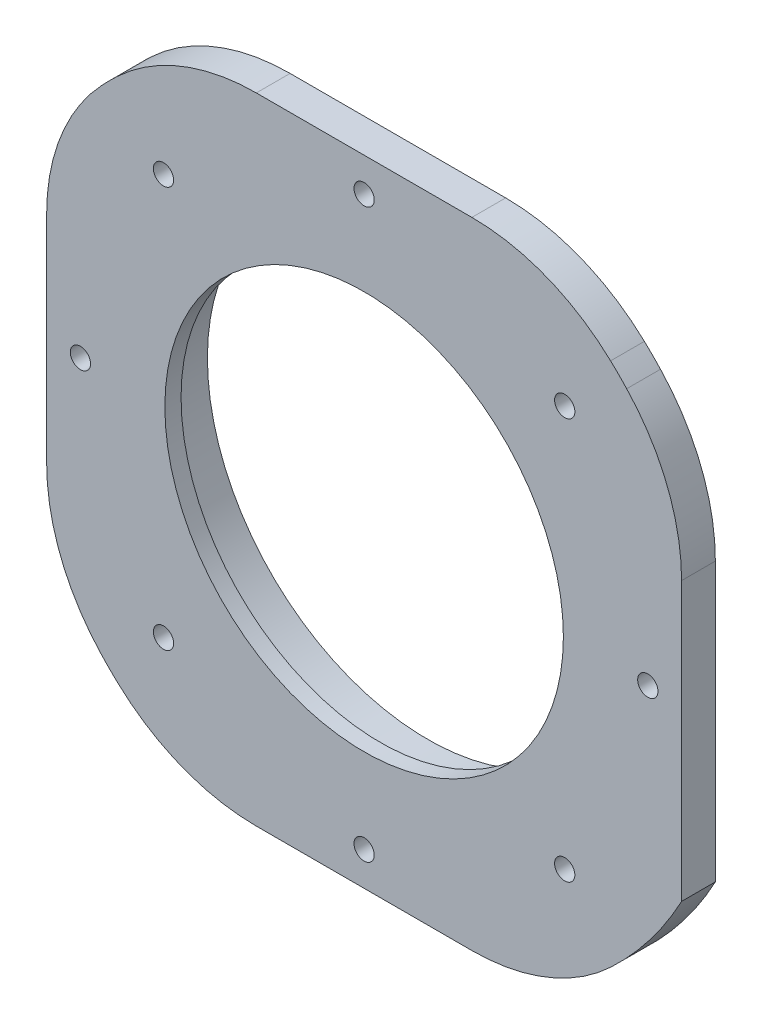
from build123d import *

# Parameters (mm, degrees)
SKETCH1_R               = 36
BOSS_EXTRUDE1_DEPTH     = 5
BOSS_EXTRUDE2_START     = -4.4
BOSS_EXTRUDE2_DEPTH     = 4.4
BOSS_EXTRUDE3_START     = -5
BOSS_EXTRUDE3_DEPTH     = 5
BOSS_EXTRUDE4_START     = 4.4
SKETCH3_R               = 32.7
SKETCH3_R_2             = 32.6
BOSS_EXTRUDE4_DEPTH     = 4.4
CUT_EXTRUDE1_DEPTH      = 68.129427228
CUT_EXTRUDE1_DEPTH_BACK = 68.129427228
SKETCH4_R               = 32.6
BOSS_EXTRUDE5_START     = -2.4
SKETCH5_R               = 29.5
BOSS_EXTRUDE5_DEPTH     = 2.4
CUT_EXTRUDE3_DEPTH      = 68.129427228
CUT_EXTRUDE3_DEPTH_BACK = 68.129427228
SKETCH6_R               = 1.5


with BuildPart() as part:
    # Sketch1 → Boss-Extrude1 (new body)
    # profile 1 of 3: a face of its own
    with BuildSketch(Plane.XY):
        with BuildLine():
            Line((15.957693357, 47), (-15.957693357, 47))
            ThreePointArc((-15.957693357, 47), (-26.99865268, 44.894394011), (-36.489751331, 38.873147815))
            ThreePointArc((-36.489751331, 38.873147815), (-37.700288946, 37.700288946), (-38.873147815, 36.489751331))
            ThreePointArc((-38.873147815, 36.489751331), (-44.894394011, 26.99865268), (-47, 15.957693357))
            Line((-47, 15.957693357), (-47, -15.957693357))
            ThreePointArc((-47, -15.957693357), (-44.894394011, -26.99865268), (-38.873147815, -36.489751331))
            ThreePointArc((-38.873147815, -36.489751331), (-37.700288946, -37.700288946), (-36.489751331, -38.873147815))
            ThreePointArc((-36.489751331, -38.873147815), (-26.99865268, -44.894394011), (-15.957693357, -47))
            Line((-15.957693357, -47), (15.957693357, -47))
            ThreePointArc((15.957693357, -47), (26.99865268, -44.894394011), (36.489751331, -38.873147815))
            ThreePointArc((36.489751331, -38.873147815), (42.303260219, -32.45085127), (47, -25.171880606))
            Line((47, -25.171880606), (47, 15.957693357))
            ThreePointArc((47, 15.957693357), (44.894394011, 26.99865268), (38.873147815, 36.489751331))
            ThreePointArc((38.873147815, 36.489751331), (37.700288946, 37.700288946), (36.489751331, 38.873147815))
            ThreePointArc((36.489751331, 38.873147815), (26.99865268, 44.894394011), (15.957693357, 47))
        make_face()
        Circle(SKETCH1_R, mode=Mode.SUBTRACT)
    # profile 2 of 3: a face of its own
    with BuildSketch(Plane.XY):
        with BuildLine():
            ThreePointArc((35.529282793, -5.802591166), (35.882127728, -2.910826297), (36, 0))
            ThreePointArc((36, 0), (35.999320343, 0.221212273), (35.997281396, 0.442416194))
            ThreePointArc((35.997281396, 0.442416194), (33.655628155, 2.522140659), (35.661160217, 4.927641625))
            ThreePointArc((35.661160217, 4.927641625), (35.097404839, 8.010753622), (34.267618722, 11.03314584))
            ThreePointArc((34.267618722, 11.03314584), (31.416989017, 12.330259572), (32.62438706, 15.220031833))
            ThreePointArc((32.62438706, 15.220031833), (31.176914536, 18), (29.493127743, 20.64353206))
            ThreePointArc((29.493127743, 20.64353206), (26.386812533, 21.042780813), (26.688793942, 24.16005542))
            ThreePointArc((26.688793942, 24.16005542), (24.48621856, 26.389867386), (22.098042936, 28.419649864))
            ThreePointArc((22.098042936, 28.419649864), (19.01205196, 27.885558633), (18.381784361, 30.953352059))
            ThreePointArc((18.381784361, 30.953352059), (15.619814608, 32.434879244), (12.739450039, 33.67055706))
            ThreePointArc((12.739450039, 33.67055706), (9.947987136, 32.250582195), (8.441472573, 34.996307531))
            ThreePointArc((8.441472573, 34.996307531), (5.365521582, 35.597909744), (2.248901099, 35.9296875))
            ThreePointArc((2.248901099, 35.9296875), (0, 33.75), (-2.248901099, 35.9296875))
            ThreePointArc((-2.248901099, 35.9296875), (-5.365521582, 35.597909744), (-8.441472573, 34.996307531))
            ThreePointArc((-8.441472573, 34.996307531), (-9.947987136, 32.250582195), (-12.739450039, 33.67055706))
            ThreePointArc((-12.739450039, 33.67055706), (-15.619814608, 32.434879244), (-18.381784361, 30.953352059))
            ThreePointArc((-18.381784361, 30.953352059), (-19.01205196, 27.885558633), (-22.098042936, 28.419649864))
            ThreePointArc((-22.098042936, 28.419649864), (-24.48621856, 26.389867386), (-26.688793942, 24.16005542))
            ThreePointArc((-26.688793942, 24.16005542), (-26.386812533, 21.042780813), (-29.493127743, 20.64353206))
            ThreePointArc((-29.493127743, 20.64353206), (-31.176914536, 18), (-32.62438706, 15.220031833))
            ThreePointArc((-32.62438706, 15.220031833), (-31.416989017, 12.330259572), (-34.267618722, 11.03314584))
            ThreePointArc((-34.267618722, 11.03314584), (-35.097404839, 8.010753622), (-35.661160217, 4.927641625))
            ThreePointArc((-35.661160217, 4.927641625), (-33.655628155, 2.522140659), (-35.997281396, 0.442416194))
            ThreePointArc((-35.997281396, 0.442416194), (-35.899336699, -2.690283369), (-35.529282793, -5.802591166))
            ThreePointArc((-35.529282793, -5.802591166), (-32.903817036, -7.510081521), (-34.528427647, -10.187624072))
            ThreePointArc((-34.528427647, -10.187624072), (-33.511454951, -13.152276877), (-32.240472674, -16.017238268))
            ThreePointArc((-32.240472674, -16.017238268), (-29.228357378, -16.875), (-29.991571576, -19.912449232))
            ThreePointArc((-29.991571576, -19.912449232), (-28.145933369, -22.445632867), (-26.086955074, -24.808683459))
            ThreePointArc((-26.086955074, -24.808683459), (-22.9558299, -24.740500674), (-22.789832754, -27.867965894))
            ThreePointArc((-22.789832754, -27.867965894), (-20.27952209, -29.744595875), (-17.615497035, -31.395768253))
            ThreePointArc((-17.615497035, -31.395768253), (-14.643576195, -30.407699292), (-13.563117281, -33.347291489))
            ThreePointArc((-13.563117281, -33.347291489), (-10.611186279, -34.400621008), (-7.57882478, -35.19320126))
            ThreePointArc((-7.57882478, -35.19320126), (-5.030176483, -33.373040385), (-3.131259316, -35.863563893))
            ThreePointArc((-3.131259316, -35.863563893), (0, -36), (3.131259316, -35.863563893))
            ThreePointArc((3.131259316, -35.863563893), (5.030176483, -33.373040385), (7.57882478, -35.19320126))
            ThreePointArc((7.57882478, -35.19320126), (10.611186279, -34.400621008), (13.563117281, -33.347291489))
            ThreePointArc((13.563117281, -33.347291489), (14.643576195, -30.407699292), (17.615497035, -31.395768253))
            ThreePointArc((17.615497035, -31.395768253), (20.27952209, -29.744595875), (22.789832754, -27.867965894))
            ThreePointArc((22.789832754, -27.867965894), (22.9558299, -24.740500674), (26.086955074, -24.808683459))
            ThreePointArc((26.086955074, -24.808683459), (28.145933369, -22.445632867), (29.991571576, -19.912449232))
            ThreePointArc((29.991571576, -19.912449232), (29.228357378, -16.875), (32.240472674, -16.017238268))
            ThreePointArc((32.240472674, -16.017238268), (33.511454951, -13.152276877), (34.528427647, -10.187624072))
            ThreePointArc((34.528427647, -10.187624072), (32.903817036, -7.510081521), (35.529282793, -5.802591166))
        make_face()
        with BuildLine():
            ThreePointArc((-32.7, 0), (0, 32.7), (32.7, 0))
            ThreePointArc((32.7, 0), (0, -32.7), (-32.7, 0))
        make_face(mode=Mode.SUBTRACT)
    # profile 3 of 3: a face of its own
    with BuildSketch(Plane.XY):
        with BuildLine():
            ThreePointArc((32.7, 0), (0, 32.7), (-32.7, 0))
            ThreePointArc((-32.7, 0), (0, -32.7), (32.7, 0))
        make_face()
    extrude(amount=BOSS_EXTRUDE1_DEPTH)

    # Sketch1<4> → Boss-Extrude2 (add)
    with BuildSketch(Plane.XY.offset(BOSS_EXTRUDE2_START)):
        with BuildLine():
            ThreePointArc((35.529282793, -5.802591166), (35.882127728, -2.910826297), (36, 0))
            ThreePointArc((36, 0), (35.999320343, 0.221212273), (35.997281396, 0.442416194))
            ThreePointArc((35.997281396, 0.442416194), (33.655628155, 2.522140659), (35.661160217, 4.927641625))
            ThreePointArc((35.661160217, 4.927641625), (35.097404839, 8.010753622), (34.267618722, 11.03314584))
            ThreePointArc((34.267618722, 11.03314584), (31.416989017, 12.330259572), (32.62438706, 15.220031833))
            ThreePointArc((32.62438706, 15.220031833), (31.176914536, 18), (29.493127743, 20.64353206))
            ThreePointArc((29.493127743, 20.64353206), (26.386812533, 21.042780813), (26.688793942, 24.16005542))
            ThreePointArc((26.688793942, 24.16005542), (24.48621856, 26.389867386), (22.098042936, 28.419649864))
            ThreePointArc((22.098042936, 28.419649864), (19.01205196, 27.885558633), (18.381784361, 30.953352059))
            ThreePointArc((18.381784361, 30.953352059), (15.619814608, 32.434879244), (12.739450039, 33.67055706))
            ThreePointArc((12.739450039, 33.67055706), (9.947987136, 32.250582195), (8.441472573, 34.996307531))
            ThreePointArc((8.441472573, 34.996307531), (5.365521582, 35.597909744), (2.248901099, 35.9296875))
            ThreePointArc((2.248901099, 35.9296875), (0, 33.75), (-2.248901099, 35.9296875))
            ThreePointArc((-2.248901099, 35.9296875), (-5.365521582, 35.597909744), (-8.441472573, 34.996307531))
            ThreePointArc((-8.441472573, 34.996307531), (-9.947987136, 32.250582195), (-12.739450039, 33.67055706))
            ThreePointArc((-12.739450039, 33.67055706), (-15.619814608, 32.434879244), (-18.381784361, 30.953352059))
            ThreePointArc((-18.381784361, 30.953352059), (-19.01205196, 27.885558633), (-22.098042936, 28.419649864))
            ThreePointArc((-22.098042936, 28.419649864), (-24.48621856, 26.389867386), (-26.688793942, 24.16005542))
            ThreePointArc((-26.688793942, 24.16005542), (-26.386812533, 21.042780813), (-29.493127743, 20.64353206))
            ThreePointArc((-29.493127743, 20.64353206), (-31.176914536, 18), (-32.62438706, 15.220031833))
            ThreePointArc((-32.62438706, 15.220031833), (-31.416989017, 12.330259572), (-34.267618722, 11.03314584))
            ThreePointArc((-34.267618722, 11.03314584), (-35.097404839, 8.010753622), (-35.661160217, 4.927641625))
            ThreePointArc((-35.661160217, 4.927641625), (-33.655628155, 2.522140659), (-35.997281396, 0.442416194))
            ThreePointArc((-35.997281396, 0.442416194), (-35.899336699, -2.690283369), (-35.529282793, -5.802591166))
            ThreePointArc((-35.529282793, -5.802591166), (-32.903817036, -7.510081521), (-34.528427647, -10.187624072))
            ThreePointArc((-34.528427647, -10.187624072), (-33.511454951, -13.152276877), (-32.240472674, -16.017238268))
            ThreePointArc((-32.240472674, -16.017238268), (-29.228357378, -16.875), (-29.991571576, -19.912449232))
            ThreePointArc((-29.991571576, -19.912449232), (-28.145933369, -22.445632867), (-26.086955074, -24.808683459))
            ThreePointArc((-26.086955074, -24.808683459), (-22.9558299, -24.740500674), (-22.789832754, -27.867965894))
            ThreePointArc((-22.789832754, -27.867965894), (-20.27952209, -29.744595875), (-17.615497035, -31.395768253))
            ThreePointArc((-17.615497035, -31.395768253), (-14.643576195, -30.407699292), (-13.563117281, -33.347291489))
            ThreePointArc((-13.563117281, -33.347291489), (-10.611186279, -34.400621008), (-7.57882478, -35.19320126))
            ThreePointArc((-7.57882478, -35.19320126), (-5.030176483, -33.373040385), (-3.131259316, -35.863563893))
            ThreePointArc((-3.131259316, -35.863563893), (0, -36), (3.131259316, -35.863563893))
            ThreePointArc((3.131259316, -35.863563893), (5.030176483, -33.373040385), (7.57882478, -35.19320126))
            ThreePointArc((7.57882478, -35.19320126), (10.611186279, -34.400621008), (13.563117281, -33.347291489))
            ThreePointArc((13.563117281, -33.347291489), (14.643576195, -30.407699292), (17.615497035, -31.395768253))
            ThreePointArc((17.615497035, -31.395768253), (20.27952209, -29.744595875), (22.789832754, -27.867965894))
            ThreePointArc((22.789832754, -27.867965894), (22.9558299, -24.740500674), (26.086955074, -24.808683459))
            ThreePointArc((26.086955074, -24.808683459), (28.145933369, -22.445632867), (29.991571576, -19.912449232))
            ThreePointArc((29.991571576, -19.912449232), (29.228357378, -16.875), (32.240472674, -16.017238268))
            ThreePointArc((32.240472674, -16.017238268), (33.511454951, -13.152276877), (34.528427647, -10.187624072))
            ThreePointArc((34.528427647, -10.187624072), (32.903817036, -7.510081521), (35.529282793, -5.802591166))
        make_face()
        with BuildLine():
            ThreePointArc((-32.7, 0), (0, 32.7), (32.7, 0))
            ThreePointArc((32.7, 0), (0, -32.7), (-32.7, 0))
        make_face(mode=Mode.SUBTRACT)
    extrude(amount=BOSS_EXTRUDE2_DEPTH)

    # Sketch2 → Boss-Extrude3 (add)
    with BuildSketch(Plane.XY.offset(5).offset(BOSS_EXTRUDE3_START)):
        with BuildLine():
            Line((15.957693357, 47), (-15.957693357, 47))
            ThreePointArc((-15.957693357, 47), (-26.99865268, 44.894394011), (-36.489751331, 38.873147815))
            ThreePointArc((-36.489751331, 38.873147815), (-37.700288946, 37.700288946), (-38.873147815, 36.489751331))
            ThreePointArc((-38.873147815, 36.489751331), (-44.894394011, 26.99865268), (-47, 15.957693357))
            Line((-47, 15.957693357), (-47, -15.957693357))
            ThreePointArc((-47, -15.957693357), (-44.894394011, -26.99865268), (-38.873147815, -36.489751331))
            ThreePointArc((-38.873147815, -36.489751331), (-37.700288946, -37.700288946), (-36.489751331, -38.873147815))
            ThreePointArc((-36.489751331, -38.873147815), (-26.99865268, -44.894394011), (-15.957693357, -47))
            Line((-15.957693357, -47), (15.957693357, -47))
            ThreePointArc((15.957693357, -47), (26.99865268, -44.894394011), (36.489751331, -38.873147815))
            ThreePointArc((36.489751331, -38.873147815), (42.303260219, -32.45085127), (47, -25.171880606))
            Line((47, -25.171880606), (47, 15.957693357))
            ThreePointArc((47, 15.957693357), (44.894394011, 26.99865268), (38.873147815, 36.489751331))
            ThreePointArc((38.873147815, 36.489751331), (37.700288946, 37.700288946), (36.489751331, 38.873147815))
            ThreePointArc((36.489751331, 38.873147815), (26.99865268, 44.894394011), (15.957693357, 47))
        make_face()
    extrude(amount=BOSS_EXTRUDE3_DEPTH)

    # Sketch3 → Boss-Extrude4 (add)
    with BuildSketch(Plane(origin=(0, 0, 0), x_dir=(-1, 0, 0), z_dir=(0, 0, -1)).offset(BOSS_EXTRUDE4_START)):
        Circle(SKETCH3_R)
        Circle(SKETCH3_R_2, mode=Mode.SUBTRACT)
    extrude(amount=-BOSS_EXTRUDE4_DEPTH)

    # Sketch4 → Cut-Extrude1 (cut, two sides: drawn at the far end of the back side and taken through both)
    with BuildSketch(Plane.XY.offset(5).offset(-CUT_EXTRUDE1_DEPTH_BACK)):
        Circle(SKETCH4_R)
    extrude(amount=CUT_EXTRUDE1_DEPTH + CUT_EXTRUDE1_DEPTH_BACK, mode=Mode.SUBTRACT)

    # Sketch5 → Boss-Extrude5 (add)
    with BuildSketch(Plane.XY.offset(5).offset(BOSS_EXTRUDE5_START)):
        with BuildLine():
            Line((15.957693357, 47), (-15.957693357, 47))
            ThreePointArc((-15.957693357, 47), (-26.99865268, 44.894394011), (-36.489751331, 38.873147815))
            ThreePointArc((-36.489751331, 38.873147815), (-37.700288946, 37.700288946), (-38.873147815, 36.489751331))
            ThreePointArc((-38.873147815, 36.489751331), (-44.894394011, 26.99865268), (-47, 15.957693357))
            Line((-47, 15.957693357), (-47, -15.957693357))
            ThreePointArc((-47, -15.957693357), (-44.894394011, -26.99865268), (-38.873147815, -36.489751331))
            ThreePointArc((-38.873147815, -36.489751331), (-37.700288946, -37.700288946), (-36.489751331, -38.873147815))
            ThreePointArc((-36.489751331, -38.873147815), (-26.99865268, -44.894394011), (-15.957693357, -47))
            Line((-15.957693357, -47), (15.957693357, -47))
            ThreePointArc((15.957693357, -47), (26.99865268, -44.894394011), (36.489751331, -38.873147815))
            ThreePointArc((36.489751331, -38.873147815), (42.303260219, -32.45085127), (47, -25.171880606))
            Line((47, -25.171880606), (47, 15.957693357))
            ThreePointArc((47, 15.957693357), (44.894394011, 26.99865268), (38.873147815, 36.489751331))
            ThreePointArc((38.873147815, 36.489751331), (37.700288946, 37.700288946), (36.489751331, 38.873147815))
            ThreePointArc((36.489751331, 38.873147815), (26.99865268, 44.894394011), (15.957693357, 47))
        make_face()
        Circle(SKETCH5_R, mode=Mode.SUBTRACT)
    extrude(amount=BOSS_EXTRUDE5_DEPTH)

    # Sketch6 → Cut-Extrude3 (cut, two sides: drawn at the far end of the back side and taken through both)
    with BuildSketch(Plane.XY.offset(5).offset(-CUT_EXTRUDE3_DEPTH_BACK)):
        with Locations((42, 0)):
            Circle(SKETCH6_R)
        with Locations((29.69848481, -29.69848481)):
            Circle(SKETCH6_R)
        with Locations((0, -42)):
            Circle(SKETCH6_R)
        with Locations((-29.69848481, -29.69848481)):
            Circle(SKETCH6_R)
        with Locations((-42, 0)):
            Circle(SKETCH6_R)
        with Locations((-29.69848481, 29.69848481)):
            Circle(SKETCH6_R)
        with Locations((0, 42)):
            Circle(SKETCH6_R)
        with Locations((29.69848481, 29.69848481)):
            Circle(SKETCH6_R)
    extrude(amount=CUT_EXTRUDE3_DEPTH + CUT_EXTRUDE3_DEPTH_BACK, mode=Mode.SUBTRACT)


solid = part.part
